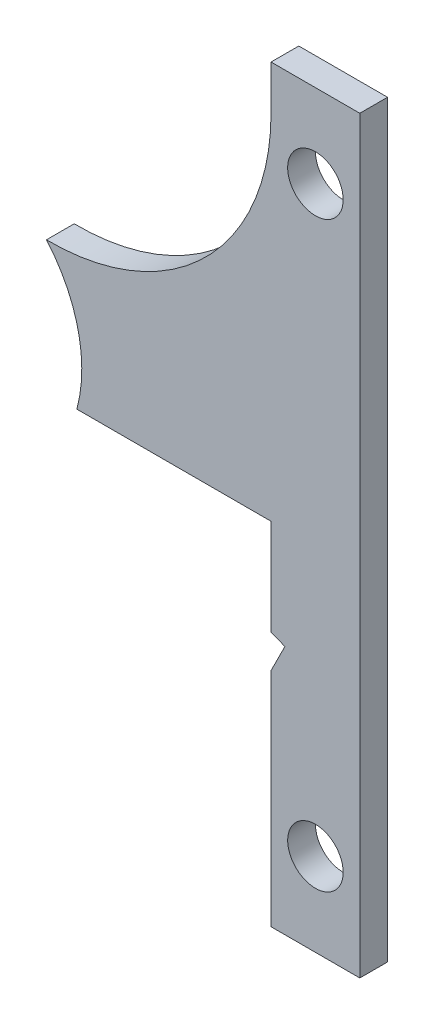
from build123d import *

# Parameters (mm, degrees)
BOSS_EXTRUDE1_DEPTH        = 2.5
F_10_0_10_DIAMETER_HOLE1_D = 10


with BuildPart() as part:
    # Sketch4 → Boss-Extrude1 (new, symmetric)
    with BuildSketch(Plane.XY):
        with BuildLine():
            Line((25, -6.698729811), (60, -6.698729811))
            Line((60, -6.698729811), (60, -24.011944979))
            Line((60, -24.011944979), (62.499998309, -25))
            Line((62.499998309, -25), (60, -30))
            Line((60, -30), (60, -70))
            Line((60, -70), (75.99999851, -70))
            Line((75.99999851, -70), (75.99999851, 62))
            Line((75.99999851, 62), (75.99999851, 65))
            Line((75.99999851, 65), (59.99999851, 65))
            Line((59.99999851, 65), (59.99999851, 62))
            Line((59.99999851, 62), (59.99999851, 57))
            ThreePointArc((59.99999851, 57), (48.111700718, 28.544206232), (19.513388562, 17.002959975))
            ThreePointArc((19.513388562, 17.002959975), (25.21513365, 5.836952637), (25, -6.698729811))
        make_face()
    extrude(amount=BOSS_EXTRUDE1_DEPTH, both=True)

    # Ø10.0 (10) Diameter Hole1 (through all)
    with Locations(Plane.XY.offset(2.5)):
        with Locations((67.99999851, 50), (67.99999851, -55)):
            Hole(F_10_0_10_DIAMETER_HOLE1_D / 2)


solid = part.part
